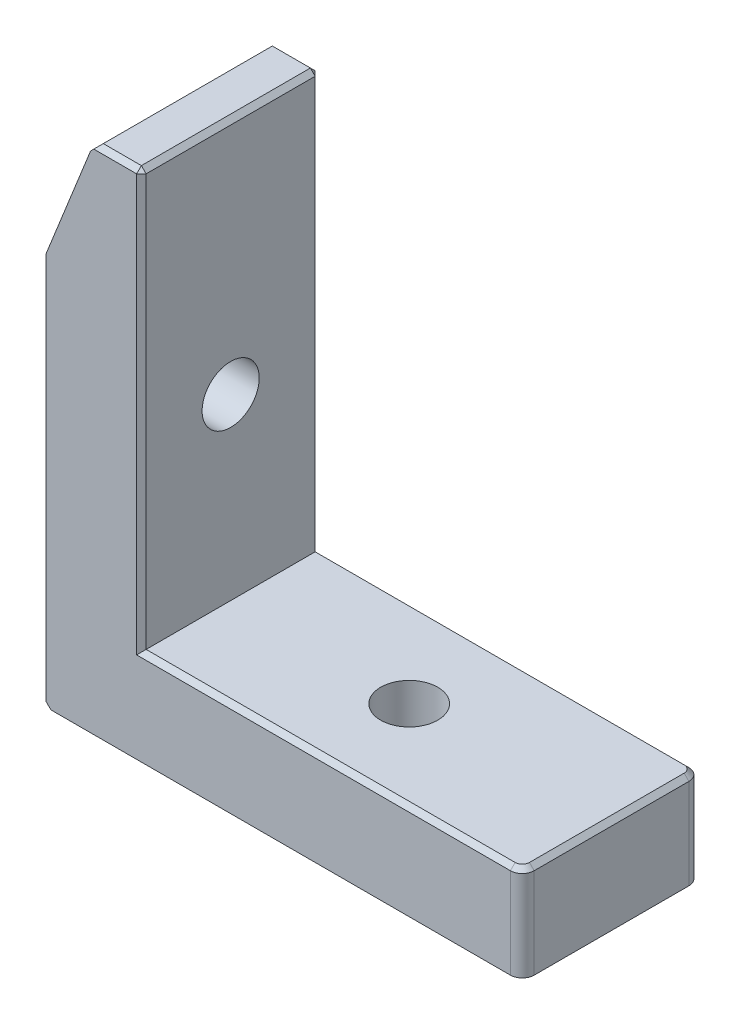
from build123d import *
from OCP.BRepFilletAPI import BRepFilletAPI_MakeChamfer

# Parameters (mm, degrees)
BOSS_EXTRUDE1_DEPTH                                  = 7.5
CSK_FOR_M4_HEX_SOCKET_COUNTERSUNK_HEAD_S_D           = 4.8
CSK_FOR_M4_HEX_SOCKET_COUNTERSUNK_HEAD_S_CSINK_D     = 9.18
CSK_FOR_M4_HEX_SOCKET_COUNTERSUNK_HEAD_S_CSINK_ANGLE = 90
CSK_FOR_M4_HEX_SOCKET_COUNTERSUNK_HE_2_D             = 4.8
CSK_FOR_M4_HEX_SOCKET_COUNTERSUNK_HE_2_CSINK_D       = 9.18
CSK_FOR_M4_HEX_SOCKET_COUNTERSUNK_HE_2_CSINK_ANGLE   = 90
FILLET1_R                                            = 1
CHAMFER1_SIZE                                        = 0.4
CHAMFER1_SIZE2                                       = 0.718021974


with BuildPart() as part:
    # Sketch1 → Boss-Extrude1 (new, symmetric)
    with BuildSketch(Plane.XY):
        Polygon((0, 0), (0, 33), (4, 43), (8, 43), (8, 8), (40, 8), (40, 0), align=None)
    extrude(amount=BOSS_EXTRUDE1_DEPTH, both=True)

    # CSK for M4 Hex Socket Countersunk Head S (through all)
    with Locations(Plane(origin=(0, 0, 0), x_dir=(-1, 0, 0), z_dir=(0, -1, 0))):
        with Locations((-23, 0)):
            CounterSinkHole(CSK_FOR_M4_HEX_SOCKET_COUNTERSUNK_HEAD_S_D / 2, CSK_FOR_M4_HEX_SOCKET_COUNTERSUNK_HEAD_S_CSINK_D / 2, counter_sink_angle=CSK_FOR_M4_HEX_SOCKET_COUNTERSUNK_HEAD_S_CSINK_ANGLE)

    # CSK for M4 Hex Socket Countersunk He 2 (through all)
    with Locations(Plane.ZY):
        with Locations((0, 23)):
            CounterSinkHole(CSK_FOR_M4_HEX_SOCKET_COUNTERSUNK_HE_2_D / 2, CSK_FOR_M4_HEX_SOCKET_COUNTERSUNK_HE_2_CSINK_D / 2, counter_sink_angle=CSK_FOR_M4_HEX_SOCKET_COUNTERSUNK_HE_2_CSINK_ANGLE)

    # Fillet1
    fillet1_edges = [part.edges().sort_by_distance(p)[0] for p in [
        (40, 4, 7.5),
        (40, 4, -7.5),
    ]]
    fillet(fillet1_edges, radius=FILLET1_R)

    # Chamfer1: one chamfer whose edges measure the first distance from different faces: ONE call of the kernel's chamfer builder (chamfer() names one face for all edges)
    chamfer1_edges_1 = [part.edges().sort_by_distance(p)[0] for p in [
        (0, 0, 0),
        (8, 43, 0),
        (8, 25.5, 7.5),
        (6, 43, 7.5),
        (40, 8, 0),
        (23.5, 8, -7.5),
        (23.5, 8, 7.5),
        (39.707106781, 8, 7.207106781),
        (39.707106781, 8, -7.207106781),
        (6, 43, -7.5),
        (8, 25.5, -7.5),
    ]]
    chamfer1_edges_2 = [part.edges().sort_by_distance(p)[0] for p in [
        (4, 43, 0),
    ]]
    chamfer1_side_2 = [part.faces().sort_by_distance(p)[0] for p in [
        (6, 43, 0),
    ]]
    chamfer1 = BRepFilletAPI_MakeChamfer(part.part.solid().wrapped)
    for e in chamfer1_edges_1:
        chamfer1.Add(CHAMFER1_SIZE, e.wrapped)
    for e in chamfer1_edges_2:
        chamfer1.Add(CHAMFER1_SIZE, CHAMFER1_SIZE2, e.wrapped, chamfer1_side_2[0].wrapped)  # the first distance lies on this face
    add(Compound.cast(chamfer1.Shape()), mode=Mode.REPLACE)


solid = part.part
